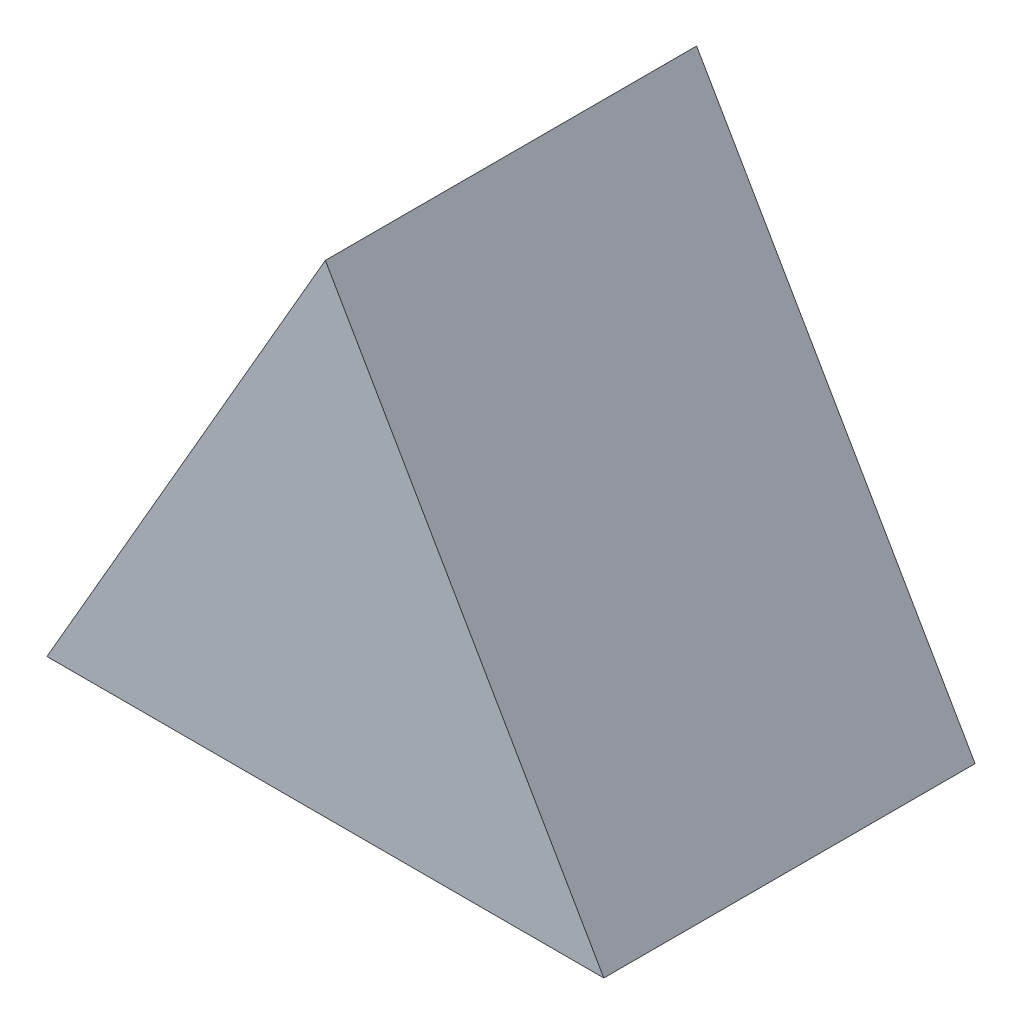
from build123d import *

# Parameters (mm, degrees)
BOSS_EXTRUDE1_DEPTH = 40


with BuildPart() as part:
    # Sketch1 → Boss-Extrude1 (new body)
    with BuildSketch(Plane.XY):
        Polygon((0, 34.641016151), (-30, -17.320508076), (30, -17.320508076), align=None)
    extrude(amount=BOSS_EXTRUDE1_DEPTH)


solid = part.part
